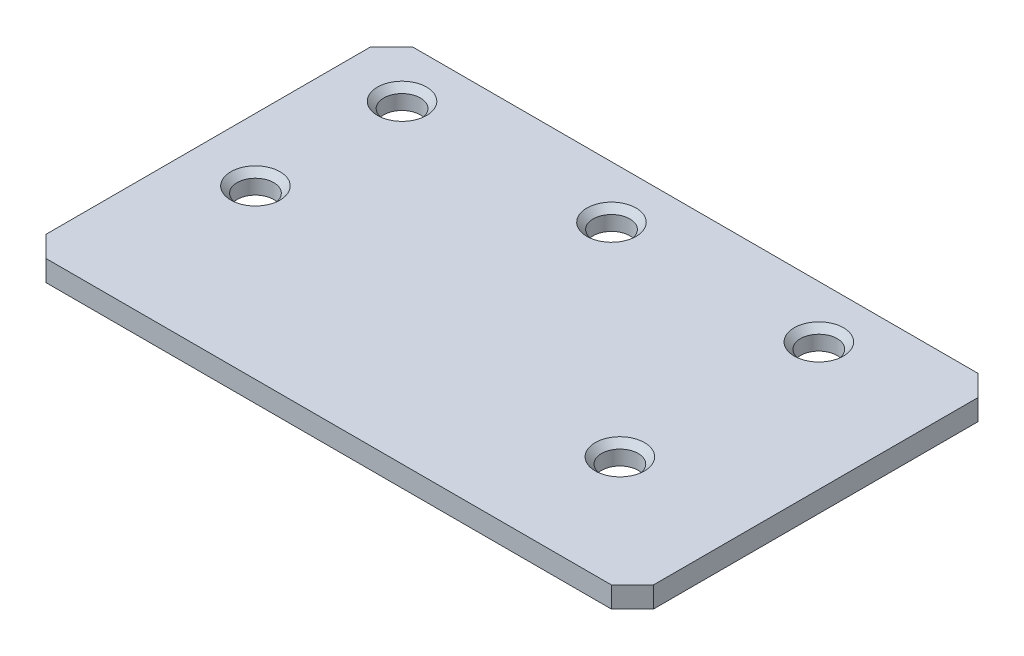
from build123d import *

# Parameters (mm, degrees)
SKETCH1_W                                    = 58
SKETCH1_H                                    = 35
BOSS_EXTRUDE1_DEPTH                          = 2
CSK_FOR_ST2_2_CROSS_RECESSED_CTSK_HE_2_COUNT = 2
CSK_FOR_ST2_2_CROSS_RECESSED_CTSK_HE_2_PITCH = 20
CSK_FOR_ST2_2_CROSS_RECESSED_CTSK_HE_3_COUNT = 2
CSK_FOR_ST2_2_CROSS_RECESSED_CTSK_HE_3_PITCH = 39.8
CSK_FOR_ST2_2_CROSS_RECESSED_CTSK_HE_4_COUNT = 2
CSK_FOR_ST2_2_CROSS_RECESSED_CTSK_HE_4_PITCH = 44.102607633
CSK_FOR_ST2_2_CROSS_RECESSED_CTSK_HE_5_COUNT = 2
CSK_FOR_ST2_2_CROSS_RECESSED_CTSK_HE_5_PITCH = 14
CHAMFER1_SIZE                                = 2


with BuildPart() as part:
    # Sketch1 → Boss-Extrude1 (new body)
    with BuildSketch(Plane(origin=(0, 0, 0), x_dir=(1, 0, 0), z_dir=(0, 1, 0))):
        Rectangle(SKETCH1_W, SKETCH1_H)
    extrude(amount=BOSS_EXTRUDE1_DEPTH)

    # Sketch3 → CSK for ST2.2 Cross recessed CTSK head tapping screws1 (revolve, cut)
    with BuildSketch(Plane(origin=(-23, 2, -12.5), x_dir=(0, 0, 1), z_dir=(1, 0, 0))):
        Polygon((0, 0), (0, 2), (1.75, 2), (1.75, 0.6), (2.35, 0), align=None)
    csk_for_st2_2_cross_recessed_ctsk_head_t = revolve(axis=Axis((-23, 8.35, -12.5), (0, -1, 0)), mode=Mode.SUBTRACT)

    # CSK for ST2.2 Cross recessed CTSK he 2: CSK for ST2.2 Cross recessed CTSK head tapping screws1 ×2
    with Locations(*[(i * CSK_FOR_ST2_2_CROSS_RECESSED_CTSK_HE_2_PITCH, 0, 0) for i in range(1, CSK_FOR_ST2_2_CROSS_RECESSED_CTSK_HE_2_COUNT)]):
        add(csk_for_st2_2_cross_recessed_ctsk_head_t, mode=Mode.SUBTRACT)

    # CSK for ST2.2 Cross recessed CTSK he 3: CSK for ST2.2 Cross recessed CTSK head tapping screws1 ×2
    with Locations(*[(i * CSK_FOR_ST2_2_CROSS_RECESSED_CTSK_HE_3_PITCH, 0, 0) for i in range(1, CSK_FOR_ST2_2_CROSS_RECESSED_CTSK_HE_3_COUNT)]):
        add(csk_for_st2_2_cross_recessed_ctsk_head_t, mode=Mode.SUBTRACT)

    # CSK for ST2.2 Cross recessed CTSK he 4: CSK for ST2.2 Cross recessed CTSK head tapping screws1 ×2
    with Locations(*[Vector(0.9024409697382602, 0, 0.4308135282670086) * (i * CSK_FOR_ST2_2_CROSS_RECESSED_CTSK_HE_4_PITCH) for i in range(1, CSK_FOR_ST2_2_CROSS_RECESSED_CTSK_HE_4_COUNT)]):
        add(csk_for_st2_2_cross_recessed_ctsk_head_t, mode=Mode.SUBTRACT)

    # CSK for ST2.2 Cross recessed CTSK he 5: CSK for ST2.2 Cross recessed CTSK head tapping screws1 ×2
    with Locations(*[(0, 0, i * CSK_FOR_ST2_2_CROSS_RECESSED_CTSK_HE_5_PITCH) for i in range(1, CSK_FOR_ST2_2_CROSS_RECESSED_CTSK_HE_5_COUNT)]):
        add(csk_for_st2_2_cross_recessed_ctsk_head_t, mode=Mode.SUBTRACT)

    # Chamfer1
    chamfer1_edges = [part.edges().sort_by_distance(p)[0] for p in [
        (29, 1, 17.5),
        (-29, 1, 17.5),
        (-29, 1, -17.5),
        (29, 1, -17.5),
    ]]
    chamfer(chamfer1_edges, length=CHAMFER1_SIZE)


solid = part.part
